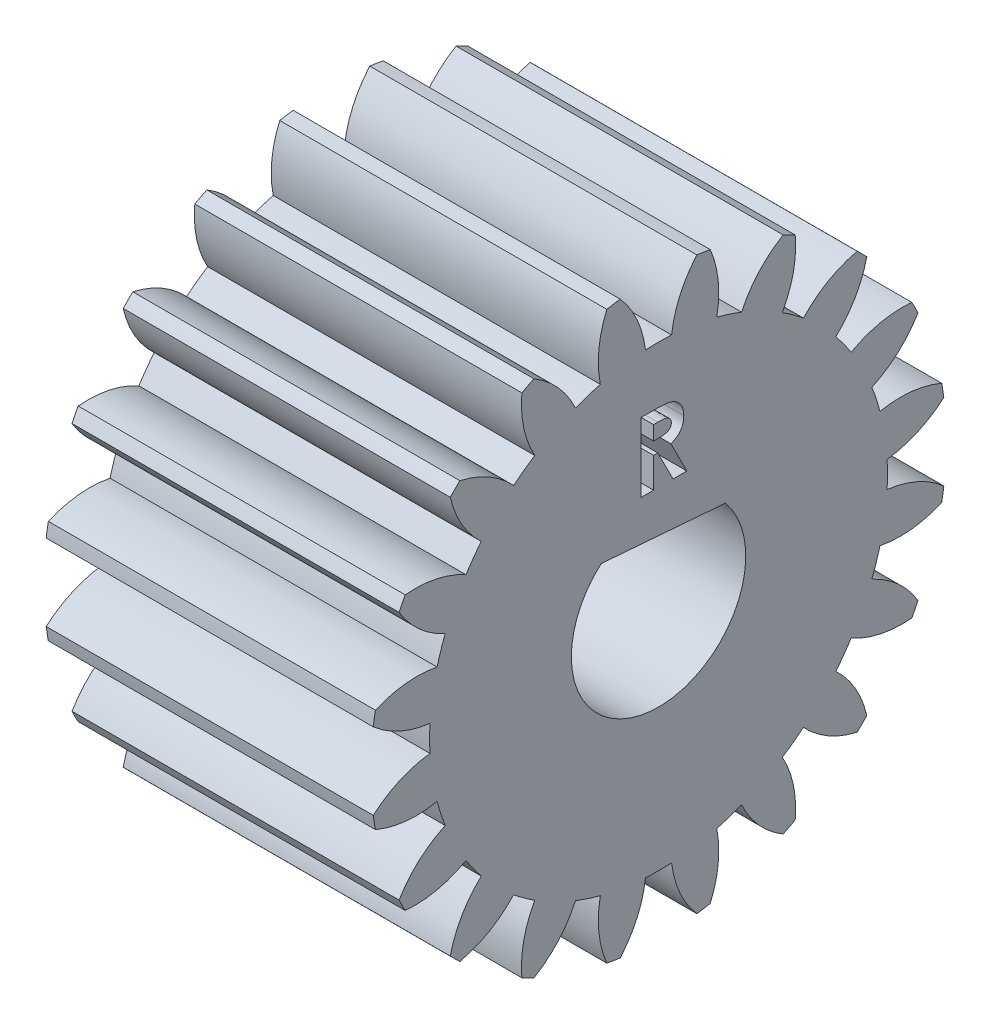
from build123d import *

# Parameters (mm, degrees)
BASPROSKE_W         = 15
BASPROSKE_H         = 13.2
TOOTHCUT_DEPTH      = 24.947442452
TEETHCUTS_COUNT     = 20
TEETHCUTS_ANGLE     = 342
BORSKE_R            = 4
BORE_DEPTH          = 50.0000508
BOSS_EXTRUDE1_START = -15
BOSS_EXTRUDE1_DEPTH = 15
SKETCH2_R           = 7.2
SKETCH2_R_2         = 6
CUT_EXTRUDE1_DEPTH  = 0.5
CUT_EXTRUDE2_DEPTH  = 2


with BuildPart() as part:
    # BasProSke → Base-Revolve (revolve)
    with BuildSketch(Plane(origin=(0, 0, 0), x_dir=(1, 0, 0), z_dir=(0, 1, 0)), mode=Mode.PRIVATE) as base_revolve_sk:
        with Locations((7.5, 6.6)):
            Rectangle(BASPROSKE_W, BASPROSKE_H)
    revolve(base_revolve_sk.sketch.rotate(Axis((-10, 0, 0), (1, 0, 0)), 180), axis=Axis((-10, 0, 0), (1, 0, 0)))

    # TooCutSke → ToothCut (cut, through all)
    with BuildSketch(Plane(origin=(0, 0, 0), x_dir=(0, 0, -1), z_dir=(1, 0, 0))):
        with BuildLine():
            ThreePointArc((0.599012827, 10.48189795), (0, 10.499), (-0.599012827, 10.48189795))
            ThreePointArc((-0.599012827, 10.48189795), (-0.986906343, 11.883983562), (-1.777012823, 13.105473306))
            ThreePointArc((-1.777012823, 13.105473306), (0, 13.2254), (1.777012823, 13.105473306))
            ThreePointArc((1.777012823, 13.105473306), (0.986906343, 11.883983562), (0.599012827, 10.48189795))
        make_face()
    toothcut = extrude(amount=TOOTHCUT_DEPTH, mode=Mode.SUBTRACT)

    # TeethCuts: ToothCut ×20 about axis
    teethcuts_axis = Axis((-10, 0, 0), (1, 0, 0))
    for i in range(1, TEETHCUTS_COUNT):
        add(toothcut.rotate(teethcuts_axis, i * TEETHCUTS_ANGLE / (TEETHCUTS_COUNT - 1)), mode=Mode.SUBTRACT)

    # BorSke → Bore (cut, symmetric)
    with BuildSketch(Plane(origin=(0, 0, 0), x_dir=(0, 0, -1), z_dir=(1, 0, 0))):
        with Locations(Location((0, 0, 0), (0, 0, 180))):
            Circle(BORSKE_R)
    extrude(amount=BORE_DEPTH, both=True, mode=Mode.SUBTRACT)

    # Sketch1 → Boss-Extrude1 (add)
    with BuildSketch(Plane.ZY.offset(BOSS_EXTRUDE1_START)):
        with BuildLine():
            Line((2.628080047, 3.015492541), (-3.067450983, 2.567244528))
            ThreePointArc((-3.067450983, 2.567244528), (-0.313836383, 3.987669335), (2.628080047, 3.015492541))
        make_face()
    extrude(amount=BOSS_EXTRUDE1_DEPTH)

    # Sketch2 → Cut-Extrude1 (cut)
    with BuildSketch(Plane.ZY):
        Circle(SKETCH2_R)
        Circle(SKETCH2_R_2, mode=Mode.SUBTRACT)
    extrude(amount=-CUT_EXTRUDE1_DEPTH, mode=Mode.SUBTRACT)

    # Sketch3 → Cut-Extrude2 (cut)
    with BuildSketch(Plane(origin=(15, 0, 0), x_dir=(0, 0, -1), z_dir=(1, 0, 0))):
        with BuildLine():
            Line((-0.796941666, 7.903919446), (-0.132939262, 7.903919446))
            add(Edge.make_bspline(
                [(-0.132939262, 7.903919446), (-0.089048905, 7.90376366), (-0.004635386, 7.903464041), (0.117084298, 7.898736838), (0.228900568, 7.892158547), (0.330978976, 7.882119901), (0.423275852, 7.86880987), (0.5058837, 7.853119545), (0.578800104, 7.835237057), (0.642640014, 7.812954065), (0.700252377, 7.787819188), (0.753955108, 7.758938753), (0.80493297, 7.726634354), (0.852845232, 7.690055974), (0.898108261, 7.649861648), (0.94080745, 7.606010919), (0.980339419, 7.558131949), (1.016459385, 7.506527272), (1.049379827, 7.452240336), (1.078474592, 7.395196603), (1.102134504, 7.335356405), (1.123040573, 7.27358456), (1.138098536, 7.208998029), (1.14857113, 7.142225572), (1.156238753, 7.073032142), (1.156679605, 7.026025199), (1.156904488, 7.002046449)],
                knots=[0, 0, 0, 0, 1.749336639, 3.364467119, 4.854658419, 6.213483162, 7.451590619, 8.570285859, 9.5643256, 10.440900261, 11.26203566, 12.067320669, 12.869050712, 13.665104639, 14.467235401, 15.27997916, 16.102287765, 16.939272006, 17.78853747, 18.631303466, 19.488103222, 20.351255419, 21.228522269, 22.127379805, 23.044756219, 24, 24, 24, 24], degree=3))
            add(Edge.make_bspline(
                [(1.156904488, 7.002046449), (1.156320322, 6.977018143), (1.15517488, 6.927942197), (1.149004904, 6.855853634), (1.137728125, 6.78688434), (1.120647804, 6.721236247), (1.101016193, 6.658092289), (1.074911187, 6.598617512), (1.045449107, 6.541946941), (1.010457856, 6.488882202), (0.972056666, 6.438244622), (0.927396891, 6.391974314), (0.879371798, 6.347584424), (0.82528172, 6.307855385), (0.767510999, 6.270100863), (0.704911791, 6.235885211), (0.637892641, 6.204348327), (0.590774859, 6.186761183), (0.566680129, 6.177767603)],
                knots=[0, 0, 0, 0, 1.099860209, 2.156625411, 3.176576793, 4.16617041, 5.135385252, 6.078461593, 7.016046972, 7.938469504, 8.868247731, 9.803980173, 10.76021508, 11.73834243, 12.748633912, 13.790971185, 14.870363756, 16, 16, 16, 16], degree=3))
            Line((0.566680129, 6.177767603), (1.299372437, 4.728919446))
            Line((1.299372437, 4.728919446), (0.665898879, 4.728919446))
            Line((0.665898879, 4.728919446), (-0.033720512, 6.112893805))
            Line((-0.033720512, 6.112893805), (-0.227069871, 6.112893805))
            Line((-0.227069871, 6.112893805), (-0.227069871, 4.728919446))
            Line((-0.227069871, 4.728919446), (-0.796941666, 4.728919446))
            Line((-0.796941666, 4.728919446), (-0.796941666, 7.903919446))
        make_face()
        with BuildLine():
            Line((-0.227069871, 6.6827656), (-0.005099719, 6.6827656))
            add(Edge.make_bspline(
                [(-0.005099719, 6.6827656), (0.022037978, 6.683071243), (0.074000835, 6.683656483), (0.148730248, 6.686371072), (0.216602377, 6.692911889), (0.277908689, 6.701175967), (0.33295767, 6.710718039), (0.381258302, 6.724392406), (0.423554827, 6.739044838), (0.459346026, 6.757254009), (0.489925205, 6.777961786), (0.516328369, 6.801486335), (0.538167571, 6.828713006), (0.556142348, 6.858901894), (0.57012477, 6.892320013), (0.580330868, 6.928600508), (0.586034567, 6.96815666), (0.586690797, 6.995455791), (0.587032693, 7.009678661)],
                knots=[0, 0, 0, 0, 1.688639943, 3.233382647, 4.650958383, 5.928841754, 7.082724185, 8.122798841, 9.049171256, 9.863274652, 10.613301712, 11.341792392, 12.054588806, 12.776240173, 13.521029143, 14.301969904, 15.115324896, 16, 16, 16, 16], degree=3))
            add(Edge.make_bspline(
                [(0.587032693, 7.009678661), (0.586386307, 7.026505354), (0.5851166, 7.059558276), (0.572517168, 7.107142893), (0.552461595, 7.151185712), (0.524970896, 7.191487736), (0.490349935, 7.226819273), (0.45061965, 7.257964304), (0.404922567, 7.282591464), (0.362610507, 7.298835276), (0.324116423, 7.308554117), (0.289376726, 7.315796511), (0.249147948, 7.320929404), (0.203399718, 7.32637375), (0.15224865, 7.329904133), (0.09541594, 7.332480609), (0.033064811, 7.333534772), (-0.010399847, 7.333871769), (-0.033084494, 7.334047651)],
                knots=[0, 0, 0, 0, 1.020303359, 2.004196876, 2.966617323, 3.9489082, 4.950758222, 5.960522915, 7.003732012, 8.091992268, 8.70421221, 9.413913587, 10.24622431, 11.166358409, 12.212345909, 13.359657661, 14.621978493, 16, 16, 16, 16], degree=3))
            Line((-0.033084494, 7.334047651), (-0.227069871, 7.334047651))
            Line((-0.227069871, 7.334047651), (-0.227069871, 6.6827656))
        make_face(mode=Mode.SUBTRACT)
    extrude(amount=-CUT_EXTRUDE2_DEPTH, mode=Mode.SUBTRACT)


solid = part.part
